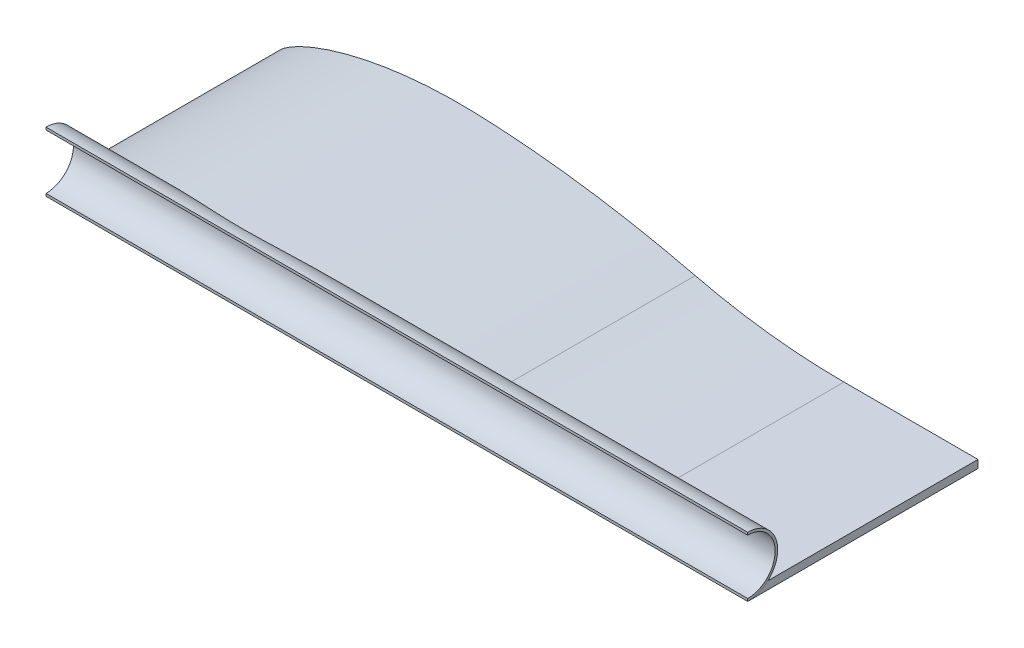
from build123d import *

# Parameters (mm, degrees)
BOSS_EXTRUDE1_DEPTH     = 185.42
FILLET1_R               = 508
BOSS_EXTRUDE2_START     = -565.049562
BOSS_EXTRUDE2_DEPTH     = 565.049574
CUT_EXTRUDE1_DEPTH      = 597.370306171
CUT_EXTRUDE1_DEPTH_BACK = 597.370306171


with BuildPart() as part:
    # Sketch1 → Boss-Extrude1 (new body)
    with BuildSketch(Plane.XY):
        with BuildLine():
            add(Edge.make_bspline(
                [(16.824486281, -3.584005936), (17.576425683, -3.584005936), (21.595703212, -3.543351385), (29.450687295, -3.173180462), (40.913314732, -2.231022297), (53.954734382, -0.933620653), (68.441844322, 0.603641829), (84.220077594, 2.261793956), (101.146412331, 3.900017255), (119.057408579, 5.371009548), (137.798850975, 6.573531856), (157.307672246, 7.348038209), (177.40159034, 7.753534803), (197.867291711, 8.106295079), (218.383935911, 8.253829905), (238.720913993, 8.211809333), (258.659276833, 7.955812655), (277.981187946, 7.500857289), (296.474222895, 6.863195832), (313.932531106, 6.083996751), (330.158311416, 5.198742586), (344.958833395, 4.265782532), (358.177232856, 3.324634453), (369.605973843, 2.442150407), (379.256357552, 1.633649638), (386.613193972, 1.003388636), (392.568540151, 0.420302648), (395.032189851, 0.27723258), (397.393838715, -0.038645243), (397.402740734, 0)],
                knots=[0.53121993, 0.53121993, 0.53121993, 0.53121993, 0.533991629, 0.546033957, 0.560220284, 0.576403357, 0.594370816, 0.613951104, 0.634916885, 0.657088503, 0.68022991, 0.704175481, 0.729090367, 0.754353776, 0.779667752, 0.80476012, 0.829359339, 0.85320871, 0.876041363, 0.897604065, 0.917662212, 0.93596986, 0.952309788, 0.966502759, 0.978350083, 0.987731492, 0.99451092, 0.998633933, 1, 1, 1, 1], degree=3))
            Line((16.824486281, -3.584005936), (563.88, -3.584005936))
            Line((563.88, -3.584005936), (563.88, 2.765994064))
            Line((563.88, 2.765994064), (388.527876564, 2.765994064))
            add(Edge.make_bspline(
                [(397.402740734, 0), (397.411698055, 0.03888532), (395.109063505, 0.667730493), (392.937979901, 1.437651493), (390.154580013, 2.277233064), (388.527876564, 2.765994064)],
                knots=[0, 0, 0, 0, 0.001374553, 0.005484497, 0.011464236, 0.011464236, 0.011464236, 0.011464236], degree=3))
        make_face()
        with BuildLine():
            add(Edge.make_bspline(
                [(397.402740734, 0), (397.411698055, 0.03888532), (395.109063505, 0.667730493), (392.784748718, 1.491991135), (387.04171407, 3.207972013), (379.954865, 5.356589699), (370.615780699, 8.058979559), (359.507412748, 11.143106331), (346.598869358, 14.543871375), (332.06110309, 18.128841799), (316.03889288, 21.806415505), (298.691944358, 25.449886624), (280.209065946, 28.958844329), (260.784413322, 32.227025229), (240.627196049, 35.159834098), (219.959471219, 37.677818053), (199.011497338, 39.711885338), (178.012037109, 41.180494444), (157.089436588, 42.139263372), (136.464680267, 42.213174939), (116.414649467, 41.217940478), (97.304330976, 39.298487784), (79.379986619, 36.549521344), (62.868119065, 33.114783487), (47.965554294, 29.173907116), (34.85097922, 24.899512861), (23.659260509, 20.503409457), (14.515298076, 16.132494214), (7.448223951, 12.010497642), (2.547126277, 8.168994228), (-0.453384309, 4.792791742), (-1.169561594, 1.105575296), (1.414868301, -1.604103887), (5.700982636, -2.840772697), (11.755524499, -3.574452069), (19.698764161, -3.632745796), (29.450687295, -3.173180462), (40.913314732, -2.231022297), (53.954734382, -0.933620653), (68.441844322, 0.603641829), (84.220077594, 2.261793956), (101.146412331, 3.900017255), (119.057408579, 5.371009548), (137.798850975, 6.573531856), (157.307672246, 7.348038209), (177.40159034, 7.753534803), (197.867291711, 8.106295079), (218.383935911, 8.253829905), (238.720913993, 8.211809333), (258.659276833, 7.955812655), (277.981187946, 7.500857289), (296.474222895, 6.863195832), (313.932531106, 6.083996751), (330.158311416, 5.198742586), (344.958833395, 4.265782532), (358.177232856, 3.324634453), (369.605973843, 2.442150407), (379.256357552, 1.633649638), (386.613193972, 1.003388636), (392.568540151, 0.420302648), (395.032189851, 0.27723258), (397.393838715, -0.038645243), (397.402740734, 0)],
                knots=[0, 0, 0, 0, 0.001374553, 0.005484497, 0.012273361, 0.021682196, 0.033580612, 0.047830743, 0.064305953, 0.082777332, 0.103063756, 0.124929017, 0.148149111, 0.172444695, 0.197572106, 0.223268881, 0.249227775, 0.275186209, 0.300900709, 0.326462938, 0.351222485, 0.374905859, 0.397269706, 0.418072414, 0.437079533, 0.454093094, 0.468919632, 0.481391712, 0.491447127, 0.499023571, 0.504293734, 0.507921918, 0.511539686, 0.516780528, 0.52421649, 0.533991629, 0.546033957, 0.560220284, 0.576403357, 0.594370816, 0.613951104, 0.634916885, 0.657088503, 0.68022991, 0.704175481, 0.729090367, 0.754353776, 0.779667752, 0.80476012, 0.829359339, 0.85320871, 0.876041363, 0.897604065, 0.917662212, 0.93596986, 0.952309788, 0.966502759, 0.978350083, 0.987731492, 0.99451092, 0.998633933, 1, 1, 1, 1], degree=3))
        make_face()
    extrude(amount=BOSS_EXTRUDE1_DEPTH)

    # Fillet1
    fillet1_edges = [part.edges().sort_by_distance(p)[0] for p in [
        (388.527876564, 2.765994064, 92.71),
    ]]
    fillet(fillet1_edges, radius=FILLET1_R)

    # Sketch2 → Boss-Extrude2 (add)
    with BuildSketch(Plane(origin=(563.88, 0, 0), x_dir=(0, 0, -1), z_dir=(1, 0, 0)).offset(BOSS_EXTRUDE2_START)):
        with BuildLine():
            Line((-185.42, 2.765994064), (-185.42, -3.584005936))
            ThreePointArc((-185.42, -3.584005936), (-176.667129042, -1.940538573), (-169.106554625, 2.765994064))
            Line((-169.106554625, 2.765994064), (-185.42, 2.765994064))
        make_face()
        with BuildLine():
            Line((-185.42, 44.675994064), (-185.42, 2.765994064))
            Line((-185.42, 2.765994064), (-169.106554625, 2.765994064))
            ThreePointArc((-169.106554625, 2.765994064), (-162.933467364, 29.298865021), (-185.42, 44.675994064))
        make_face()
    extrude(amount=BOSS_EXTRUDE2_DEPTH)

    # Sketch3 → Cut-Extrude1 (cut, two sides: drawn at the far end of the back side and taken through both)
    with BuildSketch(Plane(origin=(563.880012, 0, 0), x_dir=(0, 0, -1), z_dir=(1, 0, 0)).offset(-CUT_EXTRUDE1_DEPTH_BACK)):
        with BuildLine():
            Line((-185.42, 42.643994064), (-185.42, -1.552005936))
            ThreePointArc((-185.42, -1.552005936), (-163.322, 20.545994064), (-185.42, 42.643994064))
        make_face()
    extrude(amount=CUT_EXTRUDE1_DEPTH + CUT_EXTRUDE1_DEPTH_BACK, mode=Mode.SUBTRACT)


solid = part.part
